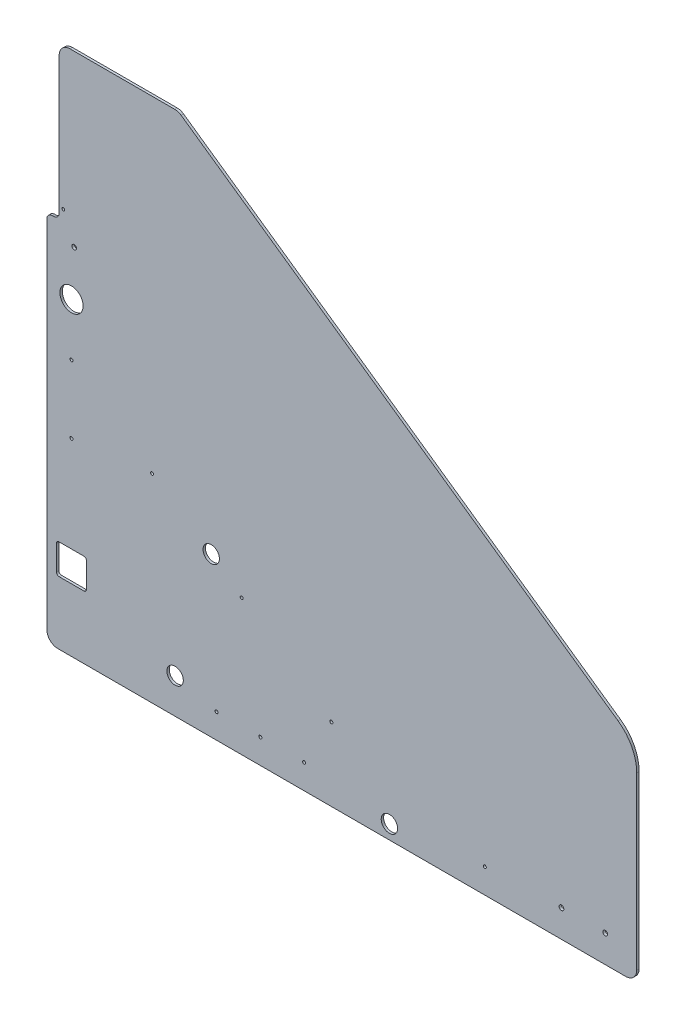
from build123d import *

# Parameters (mm, degrees)
SKETCH1_R           = 19.05
SKETCH1_R_2         = 26.987499999
SKETCH1_R_3         = 3.556
SKETCH1_R_4         = 5.55625
SKETCH1_R_5         = 3.175
SKETCH1_R_6         = 5.3578125
BOSS_EXTRUDE1_DEPTH = 5.588


with BuildPart() as part:
    # Sketch1 → Boss-Extrude1 (new body)
    with BuildSketch(Plane.XY):
        with BuildLine():
            Line((1368.43262, 25.4), (1368.43262, 421.546809256))
            ThreePointArc((1368.43262, 421.546809256), (1356.952920651, 468.460468361), (1325.107985933, 504.772656956))
            Line((1325.107985933, 504.772656956), (311.360252246, 1214.606461927))
            ThreePointArc((311.360252246, 1214.606461927), (304.42933807, 1218.024410551), (296.791410762, 1219.200000002))
            Line((296.791410762, 1219.200000002), (53.975, 1219.200000002))
            ThreePointArc((53.975, 1219.200000002), (36.014487758, 1211.760512244), (28.575, 1193.800000002))
            Line((28.575, 1193.800000002), (28.575, 876.300000002))
            ThreePointArc((28.575, 876.300000002), (24.855256121, 867.319743881), (15.875, 863.600000002))
            Line((15.875, 863.600000002), (12.7, 863.600000002))
            ThreePointArc((12.7, 863.600000002), (3.719743879, 859.880256123), (0, 850.900000002))
            Line((0, 850.900000002), (0, 25.4))
            ThreePointArc((0, 25.4), (7.439487758, 7.439487758), (25.4, 0))
            Line((25.4, 0), (1343.03262, 0))
            ThreePointArc((1343.03262, 0), (1360.993132242, 7.439487758), (1368.43262, 25.4))
        make_face()
        with Locations((794.6898, 32.562800001)):
            Circle(SKETCH1_R, mode=Mode.SUBTRACT)
        with Locations((381.27686, 367.8301)):
            Circle(SKETCH1_R, mode=Mode.SUBTRACT)
        with Locations((57.150106704, 717.550000002)):
            Circle(SKETCH1_R_2, mode=Mode.SUBTRACT)
        with Locations((297.48226, 81.5975)):
            Circle(SKETCH1_R, mode=Mode.SUBTRACT)
        with Locations((57.150106704, 595.973055669)):
            Circle(SKETCH1_R_3, mode=Mode.SUBTRACT)
        with Locations((57.150106704, 438.150000002)):
            Circle(SKETCH1_R_3, mode=Mode.SUBTRACT)
        with Locations((243.943004281, 461.107910727)):
            Circle(SKETCH1_R_3, mode=Mode.SUBTRACT)
        with Locations((452.007623531, 315.419495894)):
            Circle(SKETCH1_R_3, mode=Mode.SUBTRACT)
        with Locations((660.07224278, 169.731081062)):
            Circle(SKETCH1_R_3, mode=Mode.SUBTRACT)
        with Locations((393.7, 57.150000001)):
            Circle(SKETCH1_R_3, mode=Mode.SUBTRACT)
        with Locations((495.3, 57.150000001)):
            Circle(SKETCH1_R_3, mode=Mode.SUBTRACT)
        with Locations((596.9, 57.150000001)):
            Circle(SKETCH1_R_3, mode=Mode.SUBTRACT)
        with Locations((1016, 57.150000001)):
            Circle(SKETCH1_R_3, mode=Mode.SUBTRACT)
        with Locations((1193.80762, 63.5)):
            Circle(SKETCH1_R_4, mode=Mode.SUBTRACT)
        with Locations((1295.40762, 63.5)):
            Circle(SKETCH1_R_4, mode=Mode.SUBTRACT)
        with Locations((38.1, 889.000000002)):
            Circle(SKETCH1_R_5, mode=Mode.SUBTRACT)
        with Locations((63.5, 825.500000002)):
            Circle(SKETCH1_R_6, mode=Mode.SUBTRACT)
        with BuildLine():
            Line((22.225, 209.550000002), (22.225, 152.400000002))
            ThreePointArc((22.225, 152.400000002), (24.084871939, 147.909871941), (28.575, 146.050000002))
            Line((28.575, 146.050000002), (85.725, 146.050000002))
            ThreePointArc((85.725, 146.050000002), (90.215128061, 147.909871941), (92.075, 152.400000002))
            Line((92.075, 152.400000002), (92.075, 209.550000002))
            ThreePointArc((92.075, 209.550000002), (90.215128061, 214.040128062), (85.725, 215.900000002))
            Line((85.725, 215.900000002), (28.575, 215.900000002))
            ThreePointArc((28.575, 215.900000002), (24.084871939, 214.040128062), (22.225, 209.550000002))
        make_face(mode=Mode.SUBTRACT)
    extrude(amount=BOSS_EXTRUDE1_DEPTH)


solid = part.part
